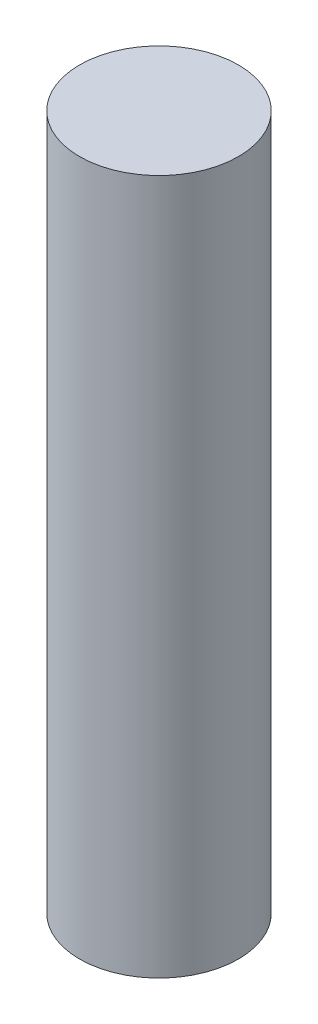
from build123d import *

# Parameters (mm, degrees)
ESQUISSE1_R        = 4
BOSS_EXTRU_1_DEPTH = 35


with BuildPart() as part:
    # Esquisse1 → Boss.-Extru.1 (new body)
    with BuildSketch(Plane(origin=(0, 0, 0), x_dir=(1, 0, 0), z_dir=(0, 1, 0))):
        with Locations(Location((0, 0, 0), (0, 0, 270))):
            Circle(ESQUISSE1_R)
    extrude(amount=BOSS_EXTRU_1_DEPTH)


solid = part.part
